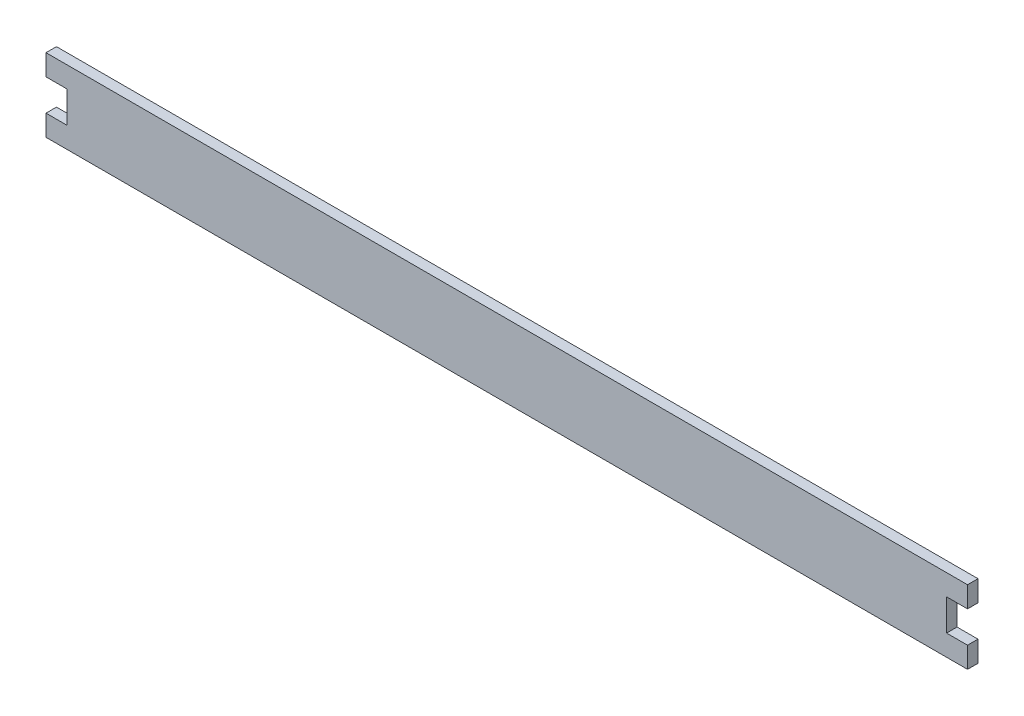
from build123d import *

# Parameters (mm, degrees)
BOSS_EXTRUDE1_DEPTH = 5


with BuildPart() as part:
    # Sketch1 → Boss-Extrude1 (new body)
    with BuildSketch(Plane.XY):
        Polygon((8.456199079, -233.363695942), (-1.543800921, -233.363695942), (-1.543800921, -243.363695942), (8.456199079, -243.363695942), (428.456199079, -243.363695942), (438.456199079, -243.363695942), (438.456199079, -233.363695942), (428.456199079, -233.363695942), (428.456199079, -218.363695942), (438.456199079, -218.363695942), (438.456199079, -208.363695942), (428.456199079, -208.363695942), (8.456199079, -208.363695942), (-1.543800921, -208.363695942), (-1.543800921, -218.363695942), (8.456199079, -218.363695942), align=None)
    extrude(amount=-BOSS_EXTRUDE1_DEPTH)


solid = part.part
